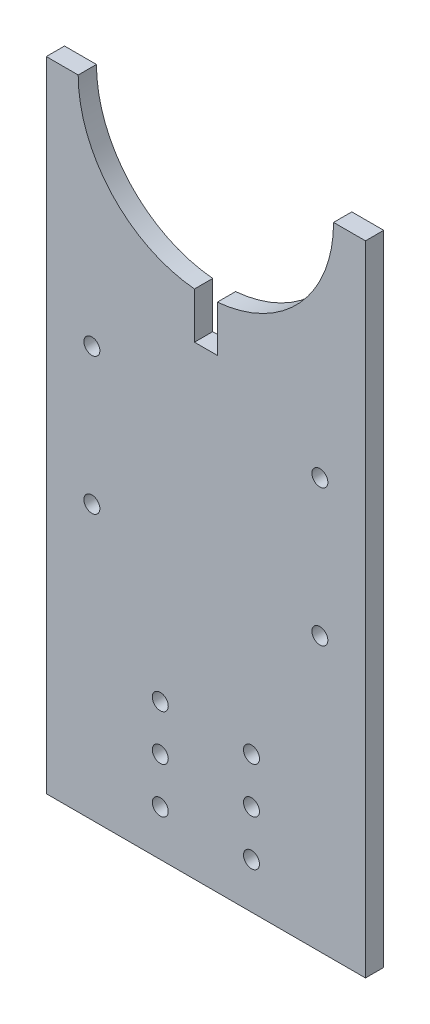
from build123d import *

# Parameters (mm, degrees)
SKETCH1_R           = 1.75
BOSS_EXTRUDE1_DEPTH = 4
SKETCH2_W           = 5
SKETCH2_H           = 38
CUT_EXTRUDE1_DEPTH  = 145.364122967
SKETCH3_W           = 8
SKETCH3_H           = 76.5
BOSS_EXTRUDE2_DEPTH = 5
FILLET1_R           = 2
SKETCH4_R           = 1.75
CUT_EXTRUDE2_DEPTH  = 145.395290782


with BuildPart() as part:
    # Sketch1 → Boss-Extrude1 (new body)
    with BuildSketch(Plane.XY):
        with BuildLine():
            Line((-35, 140), (-28, 140))
            ThreePointArc((-28, 140), (0, 112), (28, 140))
            Line((28, 140), (35, 140))
            Line((35, 140), (35, 0))
            Line((35, 0), (-35, 0))
            Line((-35, 0), (-35, 140))
        make_face()
        with Locations((-25, 60)):
            Circle(SKETCH1_R, mode=Mode.SUBTRACT)
        with Locations((25, 60)):
            Circle(SKETCH1_R, mode=Mode.SUBTRACT)
        with Locations((-10, 10)):
            Circle(SKETCH1_R, mode=Mode.SUBTRACT)
        with Locations((10, 10)):
            Circle(SKETCH1_R, mode=Mode.SUBTRACT)
        with Locations((-10, 20)):
            Circle(SKETCH1_R, mode=Mode.SUBTRACT)
        with Locations((10, 20)):
            Circle(SKETCH1_R, mode=Mode.SUBTRACT)
        with Locations((-10, 30)):
            Circle(SKETCH1_R, mode=Mode.SUBTRACT)
        with Locations((10, 30)):
            Circle(SKETCH1_R, mode=Mode.SUBTRACT)
    extrude(amount=BOSS_EXTRUDE1_DEPTH)

    # Sketch2 → Cut-Extrude1 (cut, through all)
    with BuildSketch(Plane(origin=(0, 0, 0), x_dir=(-1, 0, 0), z_dir=(0, 0, -1))):
        with Locations((0, 121)):
            Rectangle(SKETCH2_W, SKETCH2_H)
    extrude(amount=-CUT_EXTRUDE1_DEPTH, mode=Mode.SUBTRACT)

    # Sketch3 → Boss-Extrude2 (add)
    with BuildSketch(Plane(origin=(0, 0, 0), x_dir=(-1, 0, 0), z_dir=(0, 0, -1))):
        with Locations((0, 58.75)):
            Rectangle(SKETCH3_W, SKETCH3_H)
    extrude(amount=BOSS_EXTRUDE2_DEPTH)

    # Fillet1
    fillet1_edges = [part.edges().sort_by_distance(p)[0] for p in [
        (4, 58.75, -5),
        (-4, 58.75, -5),
    ]]
    fillet(fillet1_edges, radius=FILLET1_R)

    # Sketch4 → Cut-Extrude2 (cut, through all)
    with BuildSketch(Plane(origin=(0, 0, 0), x_dir=(-1, 0, 0), z_dir=(0, 0, -1))):
        with Locations((-25, 90)):
            Circle(SKETCH4_R)
        with Locations((25, 90)):
            Circle(SKETCH4_R)
    extrude(amount=-CUT_EXTRUDE2_DEPTH, mode=Mode.SUBTRACT)


solid = part.part
